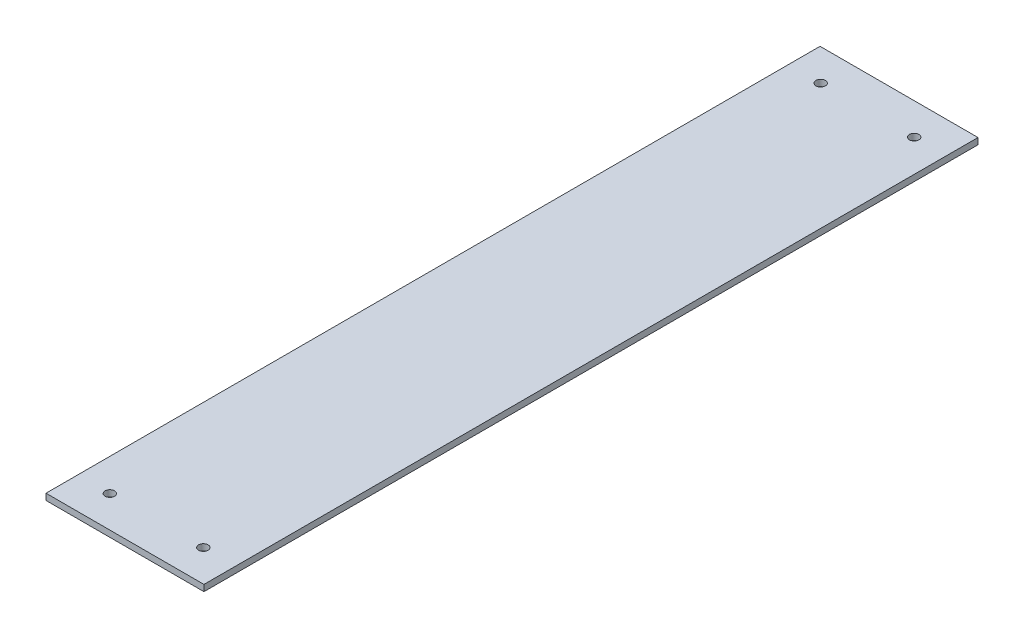
from build123d import *

# Parameters (mm, degrees)
SKETCH_1_W      = 50
SKETCH_1_H      = 245
SKETCH_1_R      = 1.5
EXTRUDE_1_DEPTH = 2


with BuildPart() as part:
    # 草图1 → 凸台-拉伸1 (new body)
    with BuildSketch(Plane(origin=(0, 0, 0), x_dir=(1, 0, 0), z_dir=(0, 1, 0))):
        with Locations((25, 122.5)):
            Rectangle(SKETCH_1_W, SKETCH_1_H)
        with Locations(Location((10.2, 10, 0), (0, 0, 270))):
            Circle(SKETCH_1_R, mode=Mode.SUBTRACT)
        with Locations(Location((39.8, 10, 0), (0, 0, 270))):
            Circle(SKETCH_1_R, mode=Mode.SUBTRACT)
        with Locations(Location((39.8, 235, 0), (0, 0, 90))):
            Circle(SKETCH_1_R, mode=Mode.SUBTRACT)
        with Locations(Location((10.2, 235, 0), (0, 0, 90))):
            Circle(SKETCH_1_R, mode=Mode.SUBTRACT)
    extrude(amount=EXTRUDE_1_DEPTH)


solid = part.part
